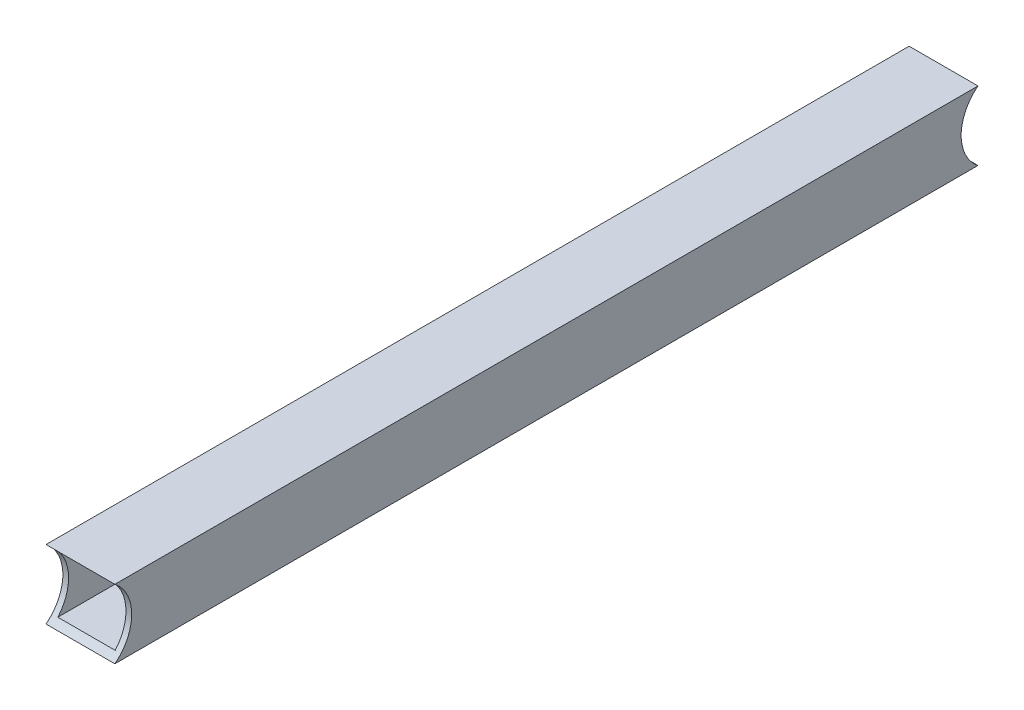
from build123d import *

# Parameters (mm, degrees)
BOSS_EXTRUDE1_DEPTH = 38.1
SKETCH3_W           = 31.75
SKETCH3_H           = 31.75
CUT_EXTRUDE1_DEPTH  = 496.262955204


with BuildPart() as part:
    # Sketch1 → Boss-Extrude1 (new body)
    with BuildSketch(Plane(origin=(0, 0, 0), x_dir=(0, 0, -1), z_dir=(1, 0, 0))):
        with BuildLine():
            ThreePointArc((24.13, 19.05), (21.675298243, 8.446305074), (14.810617813, 0))
            Line((14.810617813, 0), (492.323242187, 0))
            ThreePointArc((492.323242187, 0), (483.00386, 19.05), (492.323242187, 38.1))
            Line((492.323242187, 38.1), (14.810617813, 38.1))
            ThreePointArc((14.810617813, 38.1), (21.675298243, 29.653694926), (24.13, 19.05))
        make_face()
    extrude(amount=BOSS_EXTRUDE1_DEPTH)

    # Sketch3 → Cut-Extrude1 (cut, through all)
    with BuildSketch(Plane.XY):
        with Locations((19.05, 19.05)):
            Rectangle(SKETCH3_W, SKETCH3_H)
    extrude(amount=-CUT_EXTRUDE1_DEPTH, mode=Mode.SUBTRACT)


solid = part.part
